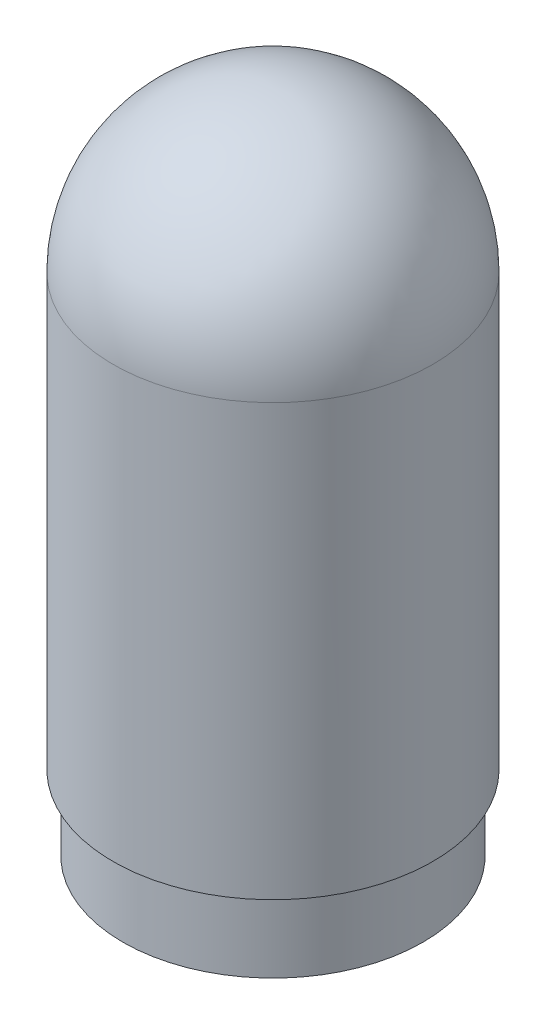
from build123d import *

# Parameters (mm, degrees)
SKETCH1_R           = 30.5
SKETCH1_R_2         = 22.5
BOSS_EXTRUDE2_DEPTH = 15


with BuildPart() as part:
    # Sketch1 → Boss-Extrude2 (new body)
    with BuildSketch(Plane(origin=(0, 0, 0), x_dir=(1, 0, 0), z_dir=(0, 1, 0))):
        with Locations(Location((0, 0, 0), (0, 0, 270))):
            Circle(SKETCH1_R)
        with Locations(Location((0, 0, 0), (0, 0, 270))):
            Circle(SKETCH1_R_2, mode=Mode.SUBTRACT)
    extrude(amount=BOSS_EXTRUDE2_DEPTH)


with BuildPart() as body_2:
    # Sketch5 → Revolve2 (revolve)
    with BuildSketch(Plane.XY):
        with BuildLine():
            Line((0, 15.208932423), (32.5, 15.208932423))
            Line((32.5, 15.208932423), (32.5, 102.70890373))
            ThreePointArc((32.5, 102.70890373), (22.980980533, 125.689892667), (0, 135.208932423))
            Line((0, 135.208932423), (0, 15.208932423))
        make_face()
    revolve(axis=Axis((0, 24.300324325, 0), (0, 1, 0)))

    # Sketch6 → Cut-Revolve2 (revolve, cut)
    with BuildSketch(Plane.XY):
        with BuildLine():
            Line((22.5, 15), (22.5, 102.70890373))
            ThreePointArc((22.5, 102.70890373), (15.909902577, 118.618806306), (0, 125.20890373))
            Line((0, 125.20890373), (0, 15))
            Line((0, 15), (22.5, 15))
        make_face()
    revolve(axis=Axis((0, 102.70890373, 0), (0, -1, 0)), mode=Mode.SUBTRACT)


solid = Compound([part.part, body_2.part])
